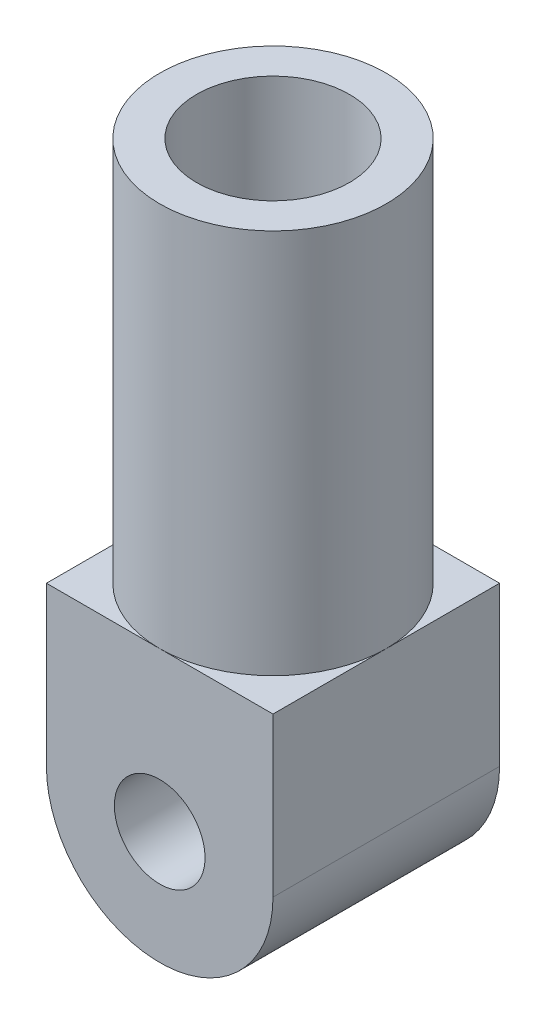
from build123d import *

# Parameters (mm, degrees)
SKETCH2_R           = 10
SKETCH2_R_2         = 6.75
BOSS_EXTRUDE1_DEPTH = 34
SKETCH3_W           = 20
SKETCH3_H           = 20
BOSS_EXTRUDE2_DEPTH = 24
CUT_EXTRUDE1_DEPTH  = 24
SKETCH5_R           = 4
CUT_EXTRUDE2_DEPTH  = 63.161081072


with BuildPart() as part:
    # Sketch2 → Boss-Extrude1 (new body)
    with BuildSketch(Plane(origin=(0, 0, 0), x_dir=(1, 0, 0), z_dir=(0, 1, 0))):
        with Locations(Location((0, 0, 0), (0, 0, 270))):
            Circle(SKETCH2_R)
        with Locations(Location((0, 0, 0), (0, 0, 270))):
            Circle(SKETCH2_R_2, mode=Mode.SUBTRACT)
    extrude(amount=-BOSS_EXTRUDE1_DEPTH)

    # Sketch3 → Boss-Extrude2 (add)
    with BuildSketch(Plane.XZ.offset(34)):
        Rectangle(SKETCH3_W, SKETCH3_H)
    extrude(amount=BOSS_EXTRUDE2_DEPTH)

    # Sketch4 → Cut-Extrude1 (cut, symmetric)
    with BuildSketch(Plane.XY):
        with BuildLine():
            Line((-10, -58), (0, -58))
            ThreePointArc((0, -58), (-7.071067812, -55.071067812), (-10, -48))
            Line((-10, -48), (-10, -58))
        make_face()
    cut_extrude1 = extrude(amount=CUT_EXTRUDE1_DEPTH, both=True, mode=Mode.SUBTRACT)

    # Mirror1: Cut-Extrude1 across plane
    add(cut_extrude1.mirror(Plane(origin=(0, 0, 0), x_dir=(0, 0, 1), z_dir=(1, 0, 0))), mode=Mode.SUBTRACT)

    # Sketch5 → Cut-Extrude2 (cut, through all)
    with BuildSketch(Plane(origin=(0, 0, -10), x_dir=(-1, 0, 0), z_dir=(0, 0, -1))):
        with Locations((0, -48)):
            Circle(SKETCH5_R)
    extrude(amount=-CUT_EXTRUDE2_DEPTH, mode=Mode.SUBTRACT)


solid = part.part
